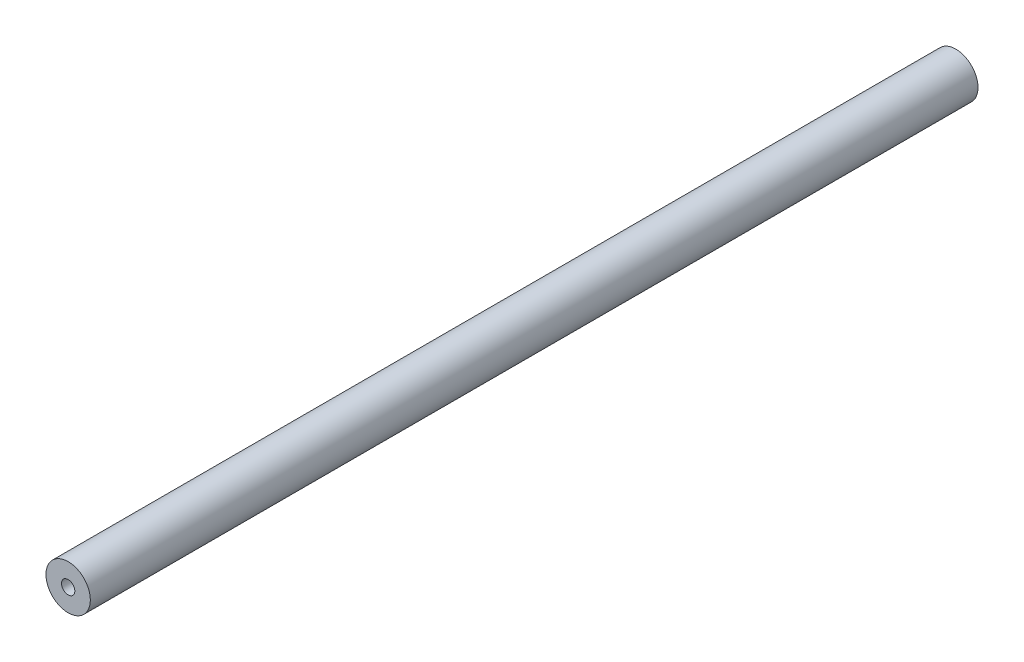
from build123d import *

# Parameters (mm, degrees)
SKETCH1_R           = 10
BOSS_EXTRUDE1_DEPTH = 400
SKETCH2_R           = 3
CUT_EXTRUDE1_DEPTH  = 20
CUT_EXTRUDE2_START  = -20
SKETCH3_R           = 3
CUT_EXTRUDE2_DEPTH  = 20


with BuildPart() as part:
    # Sketch1 → Boss-Extrude1 (new body)
    with BuildSketch(Plane.XY):
        Circle(SKETCH1_R)
    extrude(amount=BOSS_EXTRUDE1_DEPTH)

    # Sketch2 → Cut-Extrude1 (cut)
    with BuildSketch(Plane.XY.offset(400)):
        Circle(SKETCH2_R)
    extrude(amount=-CUT_EXTRUDE1_DEPTH, mode=Mode.SUBTRACT)

    # Sketch3 → Cut-Extrude2 (cut)
    with BuildSketch(Plane(origin=(0, 0, 0), x_dir=(-1, 0, 0), z_dir=(0, 0, -1)).offset(CUT_EXTRUDE2_START)):
        with Locations(Location((0, 0, 0), (0, 0, 180))):
            Circle(SKETCH3_R)
    extrude(amount=CUT_EXTRUDE2_DEPTH, mode=Mode.SUBTRACT)


solid = part.part
